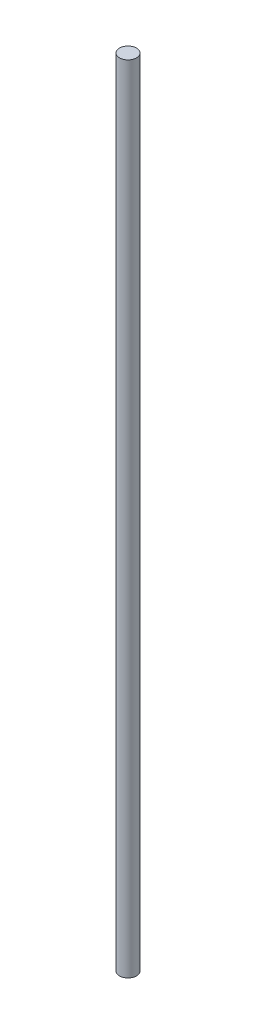
from build123d import *

# Parameters (mm, degrees)
ESQUISSE1_R        = 3
BOSS_EXTRU_1_DEPTH = 280


with BuildPart() as part:
    # Esquisse1 → Boss.-Extru.1 (new body)
    with BuildSketch(Plane(origin=(0, 0, 0), x_dir=(1, 0, 0), z_dir=(0, 1, 0))):
        with Locations(Location((0, 0, 0), (0, 0, 270))):
            Circle(ESQUISSE1_R)
    extrude(amount=BOSS_EXTRU_1_DEPTH)


solid = part.part
